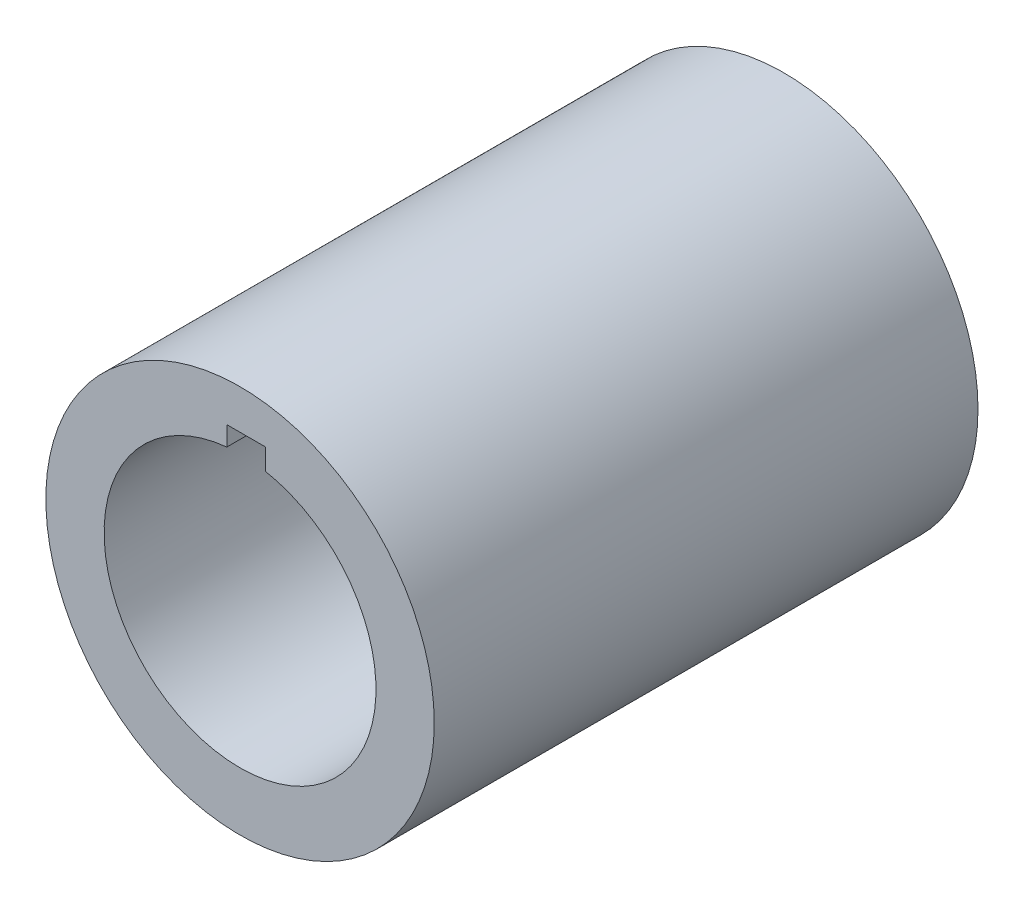
from build123d import *

# Parameters (mm, degrees)
SKETCH1_R           = 5
BOSS_EXTRUDE1_DEPTH = 14


with BuildPart() as part:
    # Sketch1 → Boss-Extrude1 (new body)
    with BuildSketch(Plane.XY):
        Circle(SKETCH1_R)
        with BuildLine():
            Line((-0.340838031, 3.483364672), (-0.340838031, 3.983364672))
            Line((-0.340838031, 3.983364672), (0.659161969, 3.983364672))
            Line((0.659161969, 3.983364672), (0.659161969, 3.437368979))
            ThreePointArc((0.659161969, 3.437368979), (-0.160814904, -3.496303558), (-0.340838031, 3.483364672))
        make_face(mode=Mode.SUBTRACT)
    extrude(amount=BOSS_EXTRUDE1_DEPTH)


solid = part.part
